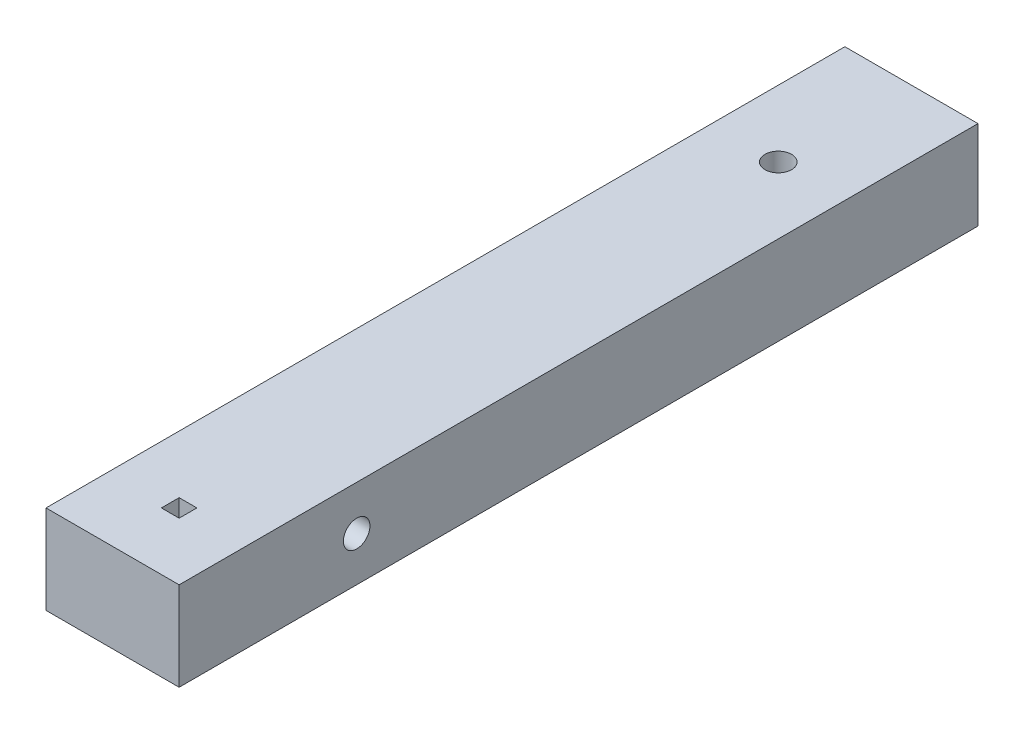
from build123d import *

# Parameters (mm, degrees)
SKETCH1_W           = 15
SKETCH1_H           = 90
BOSS_EXTRUDE1_DEPTH = 10
SKETCH2_R           = 1.5
CUT_EXTRUDE1_DEPTH  = 49.476798574
SKETCH5_W           = 2
SKETCH5_H           = 2
CUT_EXTRUDE4_DEPTH  = 47.703854231
SKETCH6_R           = 1.5
CUT_EXTRUDE5_DEPTH  = 47.703854231
SKETCH7_W           = 2
SKETCH7_H           = 2
CUT_EXTRUDE6_DEPTH  = 15


with BuildPart() as part:
    # Sketch1 → Boss-Extrude1 (new body)
    with BuildSketch(Plane(origin=(0, 0, 0), x_dir=(1, 0, 0), z_dir=(0, 1, 0))):
        Rectangle(SKETCH1_W, SKETCH1_H)
    extrude(amount=BOSS_EXTRUDE1_DEPTH)

    # Sketch2 → Cut-Extrude1 (cut, through all)
    with BuildSketch(Plane(origin=(7.5, 0, 0), x_dir=(0, 0, -1), z_dir=(1, 0, 0))):
        with Locations((-25, 5)):
            Circle(SKETCH2_R)
    extrude(amount=-CUT_EXTRUDE1_DEPTH, mode=Mode.SUBTRACT)

    # Sketch5 → Cut-Extrude4 (cut, through all)
    with BuildSketch(Plane.XZ):
        with Locations((0, 37.5)):
            Rectangle(SKETCH5_W, SKETCH5_H)
    extrude(amount=-CUT_EXTRUDE4_DEPTH, mode=Mode.SUBTRACT)

    # Sketch6 → Cut-Extrude5 (cut, through all)
    with BuildSketch(Plane(origin=(0, 10, 0), x_dir=(-1, 0, 0), z_dir=(0, 1, 0))):
        with Locations(Location((0, -30, 0), (0, 0, 90))):
            Circle(SKETCH6_R)
    extrude(amount=-CUT_EXTRUDE5_DEPTH, mode=Mode.SUBTRACT)

    # Sketch7 → Cut-Extrude6 (cut)
    with BuildSketch(Plane(origin=(0, 0, -45), x_dir=(-1, 0, 0), z_dir=(0, 0, -1))):
        with Locations((0, 5)):
            Rectangle(SKETCH7_W, SKETCH7_H)
    extrude(amount=-CUT_EXTRUDE6_DEPTH, mode=Mode.SUBTRACT)


solid = part.part
